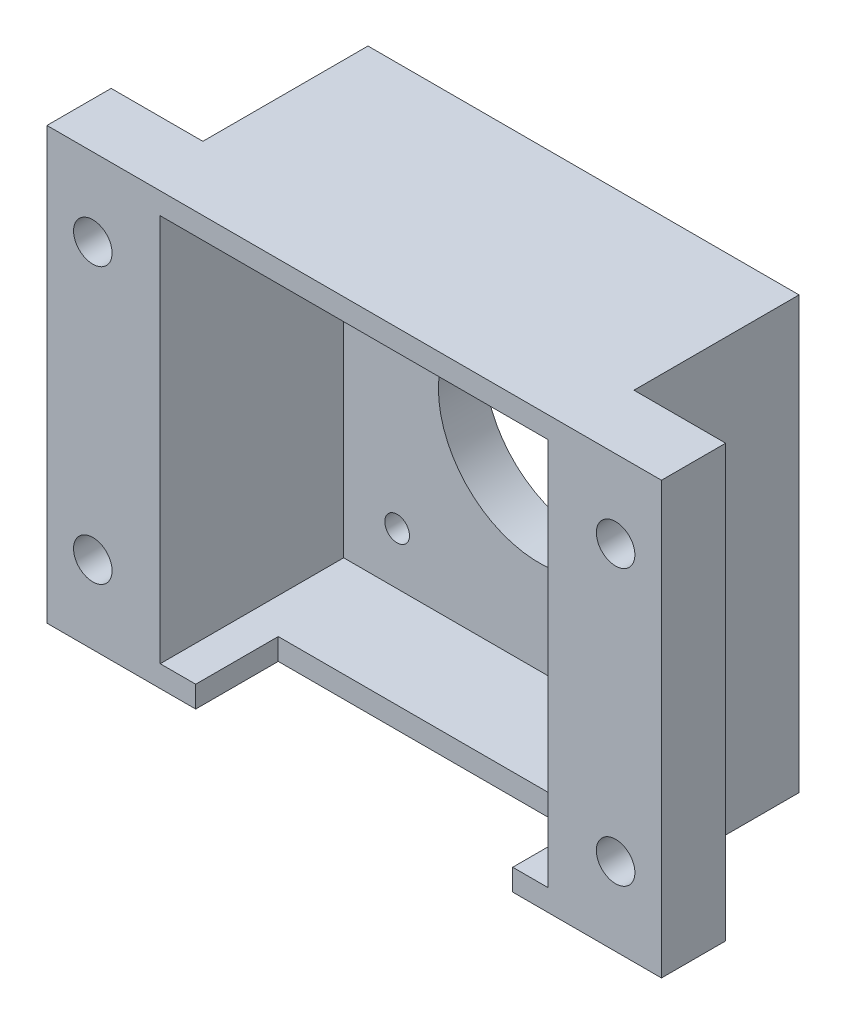
from build123d import *

# Parameters (mm, degrees)
SKETCH_1_W               = 47
SKETCH_1_H               = 47
EXTRUDE_1_DEPTH          = 53
SKETCH_2_W               = 42.3
SKETCH_2_H               = 42.3
CUT_EXTRUDE_1_DEPTH      = 48
CUT_EXTRUDE_2_DEPTH      = 59.38236035
CUT_EXTRUDE_2_DEPTH_BACK = 59.38236035
SKETCH_3_R               = 11
SKETCH_3_R_2             = 1.35
SKETCH_7_W               = 28
SKETCH_7_H               = 47.225094233
CUT_EXTRUDE_5_DEPTH      = 47.5
SKETCH_20_W              = 10
SKETCH_20_H              = 47
SKETCH_20_R              = 2.1
EXTRUDE_2_DEPTH          = 7
SKETCH_23_W              = 34.56360228
SKETCH_23_H              = 9
CUT_EXTRUDE_8_DEPTH      = 2.35


with BuildPart() as part:
    # Эскиз1 → Бобышка-Вытянуть1 (new body)
    with BuildSketch(Plane.XY):
        Rectangle(SKETCH_1_W, SKETCH_1_H)
    extrude(amount=EXTRUDE_1_DEPTH)

    # Эскиз2 → Вырез-Вытянуть1 (cut)
    with BuildSketch(Plane.XY.offset(53)):
        Rectangle(SKETCH_2_W, SKETCH_2_H)
    extrude(amount=-CUT_EXTRUDE_1_DEPTH, mode=Mode.SUBTRACT)

    # Эскиз3 → Вырез-Вытянуть2 (cut, two sides: drawn at the far end of the back side and taken through both)
    with BuildSketch(Plane.XY.offset(5).offset(-CUT_EXTRUDE_2_DEPTH_BACK)):
        with Locations((0.178742266, 0.022649375)):
            Circle(SKETCH_3_R)
        with Locations((-15.321257734, 15.522649375)):
            Circle(SKETCH_3_R_2)
        with Locations(Location((15.678742266, 15.522649375, 0), (0, 0, 180))):
            Circle(SKETCH_3_R_2)
        with Locations((15.678742266, -15.477350625)):
            Circle(SKETCH_3_R_2)
        with Locations(Location((-15.321257734, -15.477350625, 0), (0, 0, 180))):
            Circle(SKETCH_3_R_2)
    extrude(amount=CUT_EXTRUDE_2_DEPTH + CUT_EXTRUDE_2_DEPTH_BACK, mode=Mode.SUBTRACT)

    # Эскиз7 → Вырез-Вытянуть5 (cut)
    with BuildSketch(Plane(origin=(23.5, 0, 0), x_dir=(0, 0, -1), z_dir=(1, 0, 0))):
        with Locations((-39, -0.112547117)):
            Rectangle(SKETCH_7_W, SKETCH_7_H)
    extrude(amount=-CUT_EXTRUDE_5_DEPTH, mode=Mode.SUBTRACT)

    # Эскиз20 → Бобышка-Вытянуть2 (add)
    # profile 1 of 2: a face of its own
    with BuildSketch(Plane.XY.offset(25)):
        with Locations((-28.5, 0)):
            Rectangle(SKETCH_20_W, SKETCH_20_H)
        with Locations((-28.5, 15)):
            Circle(SKETCH_20_R, mode=Mode.SUBTRACT)
        with Locations(Location((-28.5, -15, 0), (0, 0, 180))):
            Circle(SKETCH_20_R, mode=Mode.SUBTRACT)
    # profile 2 of 2: a face of its own
    with BuildSketch(Plane.XY.offset(25)):
        with Locations((28.5, 0)):
            Rectangle(SKETCH_20_W, SKETCH_20_H)
        with Locations((28.5, -15)):
            Circle(SKETCH_20_R, mode=Mode.SUBTRACT)
        with Locations(Location((28.5, 15, 0), (0, 0, 180))):
            Circle(SKETCH_20_R, mode=Mode.SUBTRACT)
    extrude(amount=-EXTRUDE_2_DEPTH)

    # Эскиз23 → Вырез-Вытянуть8 (cut)
    with BuildSketch(Plane(origin=(0, -23.5, 0), x_dir=(-1, 0, 0), z_dir=(0, -1, 0))):
        with Locations((0, -20.5)):
            Rectangle(SKETCH_23_W, SKETCH_23_H)
    extrude(amount=-CUT_EXTRUDE_8_DEPTH, mode=Mode.SUBTRACT)


solid = part.part
